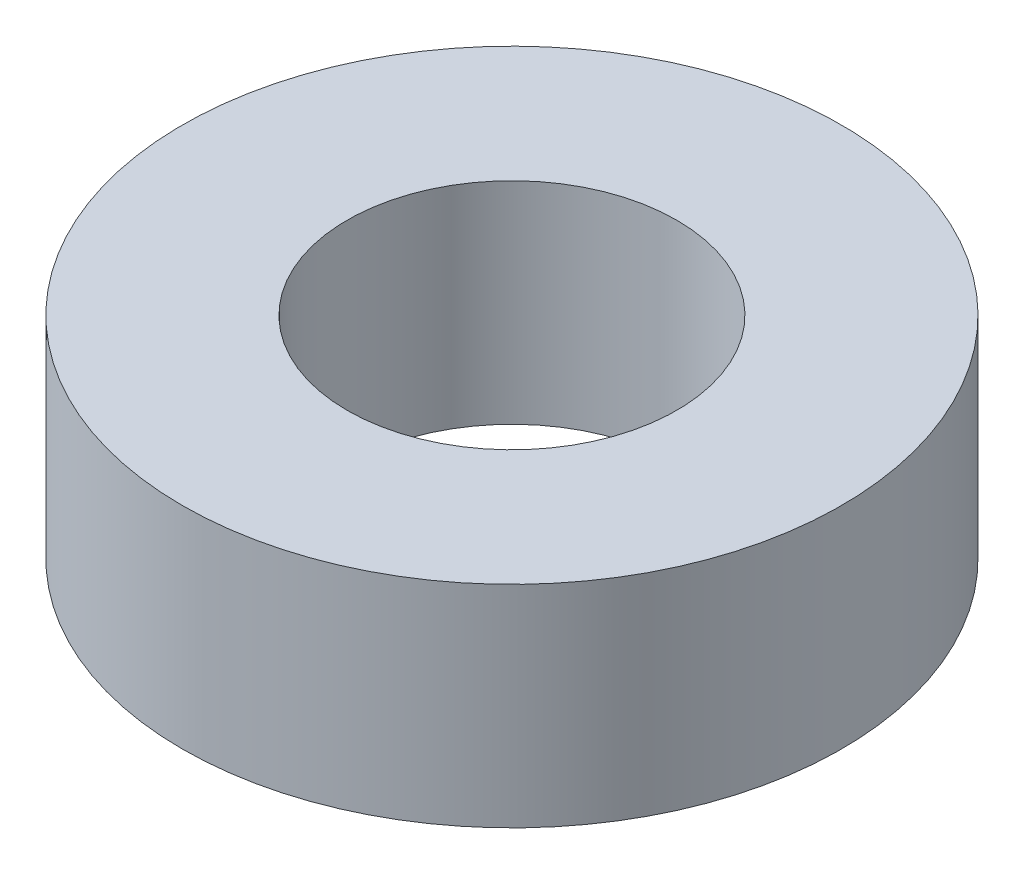
from build123d import *

# Parameters (mm, degrees)
SKETCH1_R           = 12.5
SKETCH1_R_2         = 6.25
BOSS_EXTRUDE1_DEPTH = 8


with BuildPart() as part:
    # Sketch1 → Boss-Extrude1 (new body)
    with BuildSketch(Plane(origin=(0, 0, 0), x_dir=(1, 0, 0), z_dir=(0, 1, 0))):
        with Locations(Location((0, 0, 0), (0, 0, 270))):
            Circle(SKETCH1_R)
        with Locations(Location((0, 0, 0), (0, 0, 270))):
            Circle(SKETCH1_R_2, mode=Mode.SUBTRACT)
    extrude(amount=BOSS_EXTRUDE1_DEPTH)


solid = part.part
